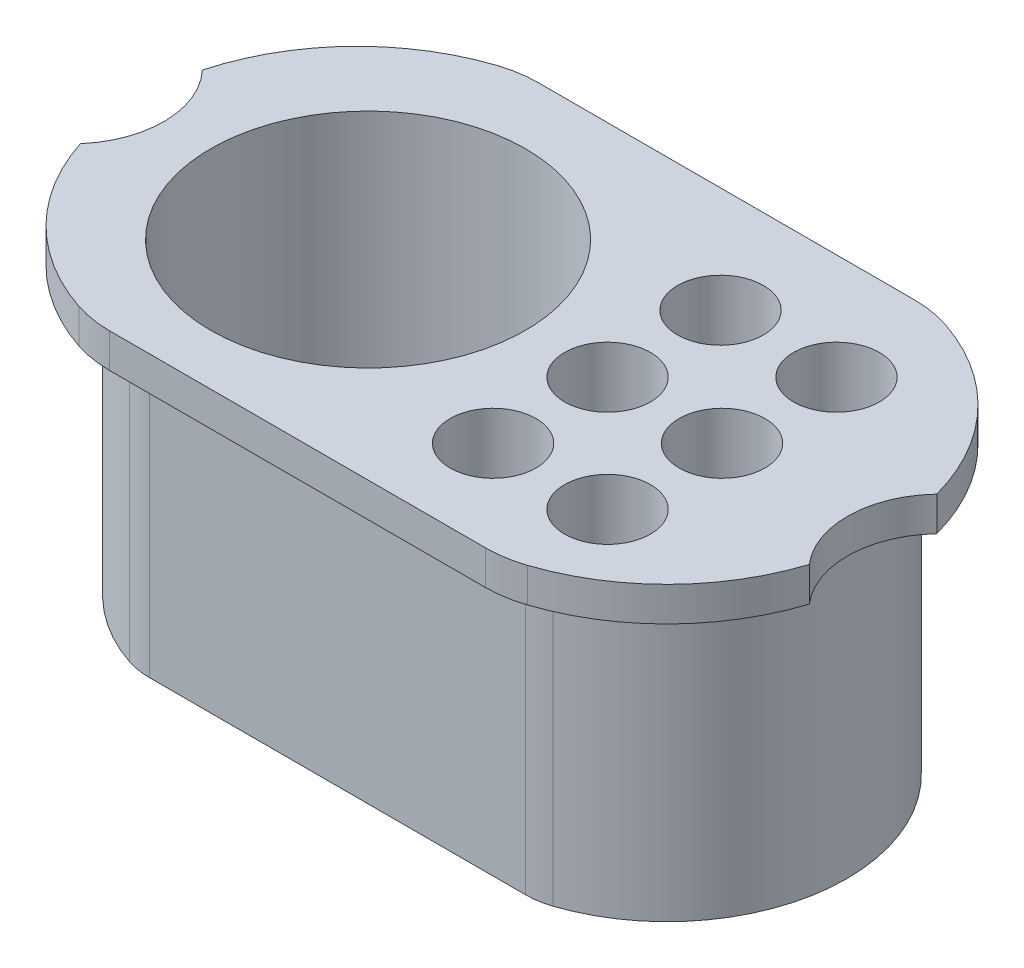
from build123d import *

# Parameters (mm, degrees)
BOSS_EXTRUDE1_DEPTH = 6
FILLET1_R           = 20
SKETCH4_W           = 3
SKETCH4_H           = 50
SKETCH6_R           = 16.245672788
CUT_EXTRUDE1_DEPTH  = 10
BOSS_EXTRUDE2_DEPTH = 3
CUT_EXTRUDE2_DEPTH  = 44
BOSS_EXTRUDE3_DEPTH = 53
SKETCH11_R          = 27.5
SKETCH11_R_2        = 7.5
CUT_EXTRUDE4_DEPTH  = 50


with BuildPart() as part:
    # Sketch1 → Boss-Extrude1 (new body)
    with BuildSketch(Plane(origin=(0, 0, 0), x_dir=(1, 0, 0), z_dir=(0, 1, 0))):
        with BuildLine():
            Line((34.540516942, 38.609131748), (-36.459483058, 38.609131748))
            ThreePointArc((-36.459483058, 38.609131748), (-66.459483058, 1.109131748), (-36.459483058, -36.390868252))
            Line((-36.459483058, -36.390868252), (34.540516942, -36.390868252))
            ThreePointArc((34.540516942, -36.390868252), (64.540516942, 1.109131748), (34.540516942, 38.609131748))
        make_face()
    extrude(amount=BOSS_EXTRUDE1_DEPTH)

    # Fillet1
    fillet1_edges = [part.edges().sort_by_distance(p)[0] for p in [
        (-36.459483058, 3, -38.609131748),
        (34.540516942, 3, -38.609131748),
        (34.540516942, 3, 36.390868252),
        (-36.459483058, 3, 36.390868252),
    ]]
    fillet(fillet1_edges, radius=FILLET1_R)

    # Sweep1: sweep along a path in Sketch3
    with BuildLine(Plane.XZ) as sweep1_path:
        Line((31.907446823, 29.390868252), (-33.82641294, 29.390868252))
        ThreePointArc((-33.82641294, 29.390868252), (-35.899239553, 29.224550102), (-37.919027907, 28.729851303))
        ThreePointArc((-37.919027907, 28.729851303), (-59.459483058, -1.109131748), (-37.919027907, -30.948114799))
        ThreePointArc((-37.919027907, -30.948114799), (-35.899239553, -31.442813598), (-33.82641294, -31.609131748))
        Line((-33.82641294, -31.609131748), (31.907446823, -31.609131748))
        ThreePointArc((31.907446823, -31.609131748), (33.980273437, -31.442813598), (36.000061791, -30.948114799))
        ThreePointArc((36.000061791, -30.948114799), (57.540516942, -1.109131748), (36.000061791, 28.729851303))
        ThreePointArc((36.000061791, 28.729851303), (33.980273437, 29.224550102), (31.907446823, 29.390868252))
    # Sketch4 → Sweep1 (sweep)
    with BuildSketch(Plane(origin=(31.907446823, 0, -31.609131748), x_dir=(0, 0, -1), z_dir=(1, 0, 0))):
        with Locations((-1.5, -25)):
            Rectangle(SKETCH4_W, SKETCH4_H)
    sweep(path=sweep1_path.line)

    # Sketch6 → Cut-Extrude1 (cut)
    with BuildSketch(Plane(origin=(0, 0, 0), x_dir=(1, 0, 0), z_dir=(0, 1, 0))):
        with Locations((75, 0)):
            Circle(SKETCH6_R)
        with Locations((-76.918966117, 0)):
            Circle(SKETCH6_R)
    extrude(amount=CUT_EXTRUDE1_DEPTH, mode=Mode.SUBTRACT)

    # Sketch7 → Boss-Extrude2 (add)
    with BuildSketch(Plane.XZ.offset(50)):
        with BuildLine():
            Line((31.907446823, 26.390868252), (-33.82641294, 26.390868252))
            ThreePointArc((-33.82641294, 26.390868252), (-35.42089495, 26.262931214), (-36.974578299, 25.882393676))
            ThreePointArc((-36.974578299, 25.882393676), (-56.459483058, -1.109131748), (-36.974578299, -28.100657171))
            ThreePointArc((-36.974578299, -28.100657171), (-35.42089495, -28.481194709), (-33.82641294, -28.609131748))
            Line((-33.82641294, -28.609131748), (31.907446823, -28.609131748))
            ThreePointArc((31.907446823, -28.609131748), (33.501928834, -28.481194709), (35.055612183, -28.100657171))
            ThreePointArc((35.055612183, -28.100657171), (54.540516942, -1.109131748), (35.055612183, 25.882393676))
            ThreePointArc((35.055612183, 25.882393676), (33.501928834, 26.262931214), (31.907446823, 26.390868252))
        make_face()
    extrude(amount=-BOSS_EXTRUDE2_DEPTH)

    # Sketch9 → Cut-Extrude2 (cut)
    with BuildSketch(Plane.XZ):
        with BuildLine():
            Line((-33.82641294, -28.609131748), (31.907446823, -28.609131748))
            ThreePointArc((31.907446823, -28.609131748), (33.501928834, -28.481194709), (35.055612183, -28.100657171))
            ThreePointArc((35.055612183, -28.100657171), (54.540516942, -1.109131748), (35.055612183, 25.882393676))
            ThreePointArc((35.055612183, 25.882393676), (33.501928834, 26.262931214), (31.907446823, 26.390868252))
            Line((31.907446823, 26.390868252), (-33.82641294, 26.390868252))
            ThreePointArc((-33.82641294, 26.390868252), (-35.42089495, 26.262931214), (-36.974578299, 25.882393676))
            ThreePointArc((-36.974578299, 25.882393676), (-56.459483058, -1.109131748), (-36.974578299, -28.100657171))
            ThreePointArc((-36.974578299, -28.100657171), (-35.42089495, -28.481194709), (-33.82641294, -28.609131748))
        make_face()
    extrude(amount=-CUT_EXTRUDE2_DEPTH, mode=Mode.SUBTRACT)

    # Sketch10 → Boss-Extrude3 (add)
    with BuildSketch(Plane(origin=(0, -47, 0), x_dir=(1, 0, 0), z_dir=(0, 1, 0))):
        with BuildLine():
            Line((31.907446823, 28.609131748), (-33.82641294, 28.609131748))
            ThreePointArc((-33.82641294, 28.609131748), (-35.42089495, 28.481194709), (-36.974578299, 28.100657171))
            ThreePointArc((-36.974578299, 28.100657171), (-56.459483058, 1.109131748), (-36.974578299, -25.882393676))
            ThreePointArc((-36.974578299, -25.882393676), (-35.42089495, -26.262931214), (-33.82641294, -26.390868252))
            Line((-33.82641294, -26.390868252), (31.907446823, -26.390868252))
            ThreePointArc((31.907446823, -26.390868252), (33.501928834, -26.262931214), (35.055612183, -25.882393676))
            ThreePointArc((35.055612183, -25.882393676), (54.540516942, 1.109131748), (35.055612183, 28.100657171))
            ThreePointArc((35.055612183, 28.100657171), (33.501928834, 28.481194709), (31.907446823, 28.609131748))
        make_face()
    extrude(amount=BOSS_EXTRUDE3_DEPTH)

    # Sketch11 → Cut-Extrude4 (cut)
    with BuildSketch(Plane(origin=(0, 6, 0), x_dir=(1, 0, 0), z_dir=(0, 1, 0))):
        with Locations(Location((-25, 0, 0), (0, 0, 270))):
            Circle(SKETCH11_R)
        with Locations(Location((16.748195248, 0.093303674, 0), (0, 0, 270))):
            Circle(SKETCH11_R_2)
        with Locations(Location((16.748195248, -19.906696326, 0), (0, 0, 270))):
            Circle(SKETCH11_R_2)
        with Locations(Location((16.486268254, 20.091588457, 0), (0, 0, 90))):
            Circle(SKETCH11_R_2)
        with Locations(Location((36.748195248, 0.093303674, 0), (0, 0, 270))):
            Circle(SKETCH11_R_2)
        with Locations(Location((36.748195248, -19.906696326, 0), (0, 0, 270))):
            Circle(SKETCH11_R_2)
        with Locations(Location((36.748195248, 20.093303674, 0), (0, 0, 270))):
            Circle(SKETCH11_R_2)
    extrude(amount=-CUT_EXTRUDE4_DEPTH, mode=Mode.SUBTRACT)


solid = part.part
